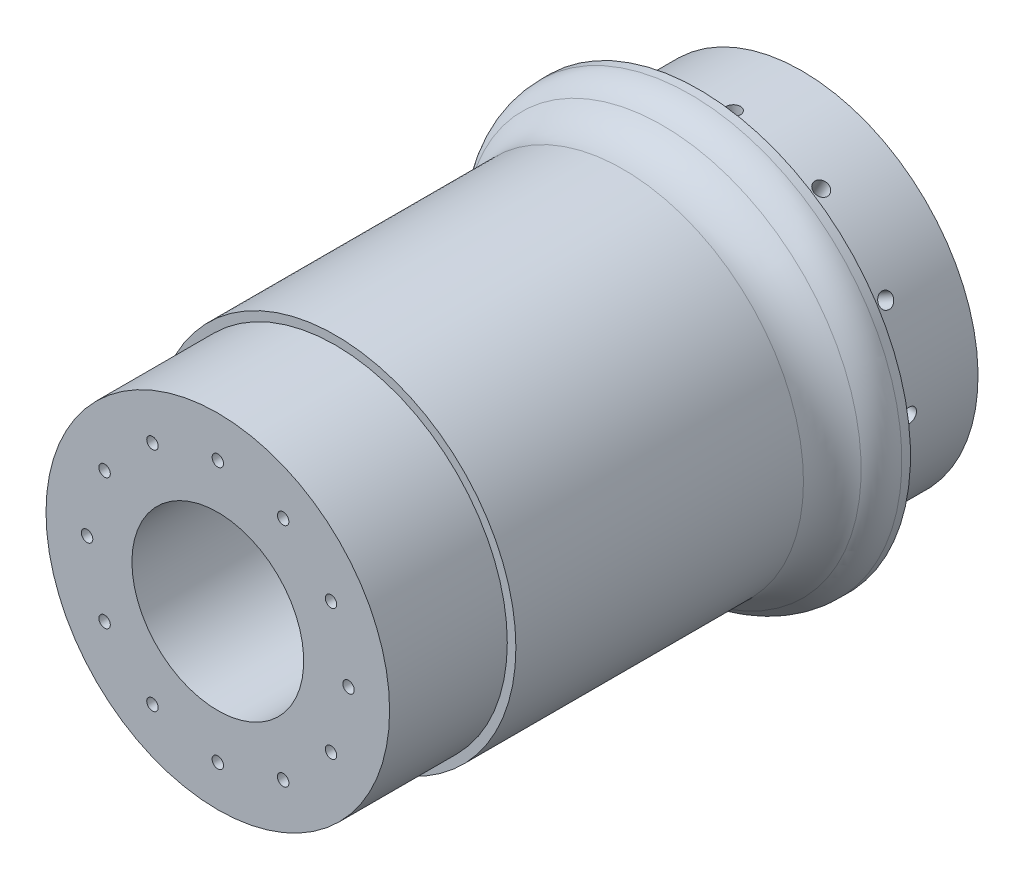
from build123d import *

# Parameters (mm, degrees)
SKETCH2_R           = 100
BOSS_EXTRUDE1_DEPTH = 68.5
SKETCH3_R           = 102.5
BOSS_EXTRUDE2_DEPTH = 60
HOLE1_D             = 8.376
HOLE1_DEPTH         = 85.864803313
HOLE2_D             = 8.376
HOLE2_DEPTH         = 85.864803313
HOLE3_D             = 8.376
HOLE3_DEPTH         = 40.780091351
HOLE4_D             = 8.376
HOLE4_DEPTH         = 85.864803313
HOLE5_D             = 8.376
HOLE5_DEPTH         = 85.864803313
HOLE6_D             = 8.376
HOLE6_DEPTH         = 40.780091351
HOLE7_D             = 8.376
HOLE7_DEPTH         = 85.864803313
HOLE8_D             = 8.376
HOLE8_DEPTH         = 85.864803313
HOLE9_D             = 8.376
HOLE9_DEPTH         = 40.780091351
HOLE10_D            = 8.376
HOLE10_DEPTH        = 85.864803313
HOLE11_D            = 8.376
HOLE11_DEPTH        = 85.864803313
HOLE12_D            = 8.376
HOLE12_DEPTH        = 40.780091351


with BuildPart() as part:
    # Sketch1 → Revolve1 (revolve)
    with BuildSketch(Plane.XZ):
        with BuildLine():
            Line((105, -68.5), (0, -68.5))
            Line((0, -68.5), (0, -280))
            Line((0, -280), (123.173723726, -280))
            Line((123.173723726, -280), (123.173723726, -275))
            ThreePointArc((123.173723726, -275), (121.202023829, -266.077620424), (115.654134038, -258.816947132))
            ThreePointArc((115.654134038, -258.816947132), (107.793603887, -248.529658909), (105, -235.887981387))
            Line((105, -235.887981387), (105, -68.5))
        make_face()
    revolve(axis=Axis((0, 0, -68.5), (0, 0, -1)))

    # Sketch2 → Boss-Extrude1 (add)
    with BuildSketch(Plane.XY.offset(-68.5)):
        Circle(SKETCH2_R)
    extrude(amount=BOSS_EXTRUDE1_DEPTH)

    # Sketch3 → Boss-Extrude2 (add)
    with BuildSketch(Plane(origin=(0, 0, -280), x_dir=(-1, 0, 0), z_dir=(0, 0, -1))):
        Circle(SKETCH3_R)
    extrude(amount=BOSS_EXTRUDE2_DEPTH)

    # Sketch4 → Cut-Revolve1 (revolve, cut)
    with BuildSketch(Plane.XZ):
        with BuildLine():
            Line((50, 0), (0, 0))
            Line((0, 0), (0, -340))
            Line((0, -340), (82.5, -340))
            Line((82.5, -340), (82.5, -153.326822519))
            ThreePointArc((82.5, -153.326822519), (78.117376915, -137.714327523), (66.25, -126.66341126))
            ThreePointArc((66.25, -126.66341126), (54.382623085, -115.612494996), (50, -100))
            Line((50, -100), (50, 0))
        make_face()
    revolve(axis=Axis((0, 0, 0), (0, 0, -1)), mode=Mode.SUBTRACT)

    # Sketch5 → Cut-Revolve2 (revolve, cut)
    with BuildSketch(Plane.XZ.offset(-76.095238095)):
        Polygon((3.3235, 0), (0, 0), (0, -18), (3.3235, -16.003039733), (3.3235, -12), align=None)
    revolve(axis=Axis((0, 76.095238095, 0), (0, 0, -1)), mode=Mode.SUBTRACT)

    # Sketch6 → Cut-Revolve3 (revolve, cut)
    with BuildSketch(Plane.XZ.offset(-65.900409298)):
        Polygon((41.371119048, 0), (38.047619048, 0), (38.047619048, -18), (41.371119048, -16.003039733), (41.371119048, -12), align=None)
    revolve(axis=Axis((38.047619048, 65.900409298, 0), (0, 0, -1)), mode=Mode.SUBTRACT)

    # Sketch7 → Cut-Revolve4 (revolve, cut)
    with BuildSketch(Plane.XZ.offset(-38.047619048)):
        Polygon((69.223909297, 0), (65.900409297, 0), (65.900409297, -18), (69.223909297, -16.003039733), (69.223909297, -12), align=None)
    revolve(axis=Axis((65.900409297, 38.047619048, 0), (0, 0, -1)), mode=Mode.SUBTRACT)

    # Sketch8 → Cut-Revolve5 (revolve, cut)
    with BuildSketch(Plane.XZ):
        Polygon((79.418738095, 0), (76.095238095, 0), (76.095238095, -18), (79.418738095, -16.003039733), (79.418738095, -12), align=None)
    revolve(axis=Axis((76.095238095, 0, 0), (0, 0, -1)), mode=Mode.SUBTRACT)

    # Sketch9 → Cut-Revolve6 (revolve, cut)
    with BuildSketch(Plane.XZ.offset(38.047619048)):
        Polygon((69.223909298, 0), (65.900409298, 0), (65.900409298, -18), (69.223909298, -16.003039733), (69.223909298, -12), align=None)
    revolve(axis=Axis((65.900409298, -38.047619048, 0), (0, 0, -1)), mode=Mode.SUBTRACT)

    # Sketch10 → Cut-Revolve7 (revolve, cut)
    with BuildSketch(Plane.XZ.offset(65.900409297)):
        Polygon((41.371119048, 0), (38.047619048, 0), (38.047619048, -18), (41.371119048, -16.003039733), (41.371119048, -12), align=None)
    revolve(axis=Axis((38.047619048, -65.900409297, 0), (0, 0, -1)), mode=Mode.SUBTRACT)

    # Sketch11 → Cut-Revolve8 (revolve, cut)
    with BuildSketch(Plane.XZ.offset(76.095238095)):
        Polygon((3.3235, 0), (0, 0), (0, -18), (3.3235, -16.003039733), (3.3235, -12), align=None)
    revolve(axis=Axis((0, -76.095238095, 0), (0, 0, -1)), mode=Mode.SUBTRACT)

    # Sketch12 → Cut-Revolve9 (revolve, cut)
    with BuildSketch(Plane.XZ.offset(65.900409297)):
        Polygon((-34.724119048, 0), (-38.047619048, 0), (-38.047619048, -18), (-34.724119048, -16.003039733), (-34.724119048, -12), align=None)
    revolve(axis=Axis((-38.047619048, -65.900409297, 0), (0, 0, -1)), mode=Mode.SUBTRACT)

    # Sketch13 → Cut-Revolve10 (revolve, cut)
    with BuildSketch(Plane.XZ.offset(38.047619048)):
        Polygon((-62.576909297, 0), (-65.900409297, 0), (-65.900409297, -18), (-62.576909297, -16.003039733), (-62.576909297, -12), align=None)
    revolve(axis=Axis((-65.900409297, -38.047619048, 0), (0, 0, -1)), mode=Mode.SUBTRACT)

    # Sketch14 → Cut-Revolve11 (revolve, cut)
    with BuildSketch(Plane.XZ):
        Polygon((-72.771738095, 0), (-76.095238095, 0), (-76.095238095, -18), (-72.771738095, -16.003039733), (-72.771738095, -12), align=None)
    revolve(axis=Axis((-76.095238095, 0, 0), (0, 0, -1)), mode=Mode.SUBTRACT)

    # Sketch15 → Cut-Revolve12 (revolve, cut)
    with BuildSketch(Plane.XZ.offset(-38.047619048)):
        Polygon((-62.576909298, 0), (-65.900409298, 0), (-65.900409298, -18), (-62.576909298, -16.003039733), (-62.576909298, -12), align=None)
    revolve(axis=Axis((-65.900409298, 38.047619048, 0), (0, 0, -1)), mode=Mode.SUBTRACT)

    # Sketch16 → Cut-Revolve13 (revolve, cut)
    with BuildSketch(Plane.XZ.offset(-65.900409298)):
        Polygon((-34.724119048, 0), (-38.047619048, 0), (-38.047619048, -18), (-34.724119048, -16.003039733), (-34.724119048, -12), align=None)
    revolve(axis=Axis((-38.047619048, 65.900409298, 0), (0, 0, -1)), mode=Mode.SUBTRACT)

    # Hole1
    with Locations(Plane(origin=(71.354978747, -41.196816188, 0), x_dir=(0, 0, 1), z_dir=(-0.8660254037844389, 0.49999999999999983, 0))):
        with Locations((-300, 0)):
            Hole(HOLE1_D / 2, depth=HOLE1_DEPTH)

    # Hole2
    with Locations(Plane(origin=(41.196816188, -71.354978747, 0), x_dir=(0.8660254037844385, 0.5000000000000004, 0), z_dir=(-0.5000000000000003, 0.8660254037844384, 0))):
        with Locations((0, 300)):
            Hole(HOLE2_D / 2, depth=HOLE2_DEPTH)

    # Hole3
    with Locations(Plane(origin=(0, -82.393632375, 0), x_dir=(1, 0, 0), z_dir=(0, 1, 0))):
        with Locations((0, 300)):
            Hole(HOLE3_D / 2, depth=HOLE3_DEPTH)

    # Hole4
    with Locations(Plane(origin=(-41.196816188, -71.354978747, 0), x_dir=(0.8660254037844387, -0.4999999999999999, 0), z_dir=(0.4999999999999999, 0.8660254037844387, 0))):
        with Locations((0, 300)):
            Hole(HOLE4_D / 2, depth=HOLE4_DEPTH)

    # Hole5
    with Locations(Plane(origin=(-71.354978747, -41.196816188, 0), x_dir=(0, 0, -1), z_dir=(0.8660254037844387, 0.4999999999999999, 0))):
        with Locations((300, 0)):
            Hole(HOLE5_D / 2, depth=HOLE5_DEPTH)

    # Hole6
    with Locations(Plane(origin=(-82.393632375, 0, 0), x_dir=(0, 0, -1), z_dir=(1, 0, 0))):
        with Locations((300, 0)):
            Hole(HOLE6_D / 2, depth=HOLE6_DEPTH)

    # Hole7
    with Locations(Plane(origin=(-71.354978747, 41.196816188, 0), x_dir=(0, 0, -1), z_dir=(0.8660254037844387, -0.4999999999999999, 0))):
        with Locations((300, 0)):
            Hole(HOLE7_D / 2, depth=HOLE7_DEPTH)

    # Hole8
    with Locations(Plane(origin=(-41.196816188, 71.354978747, 0), x_dir=(-0.8660254037844387, -0.4999999999999999, 0), z_dir=(0.4999999999999999, -0.8660254037844387, 0))):
        with Locations((0, 300)):
            Hole(HOLE8_D / 2, depth=HOLE8_DEPTH)

    # Hole9
    with Locations(Plane(origin=(0, 82.393632375, 0), x_dir=(-1, 0, 0), z_dir=(0, -1, 0))):
        with Locations((0, 300)):
            Hole(HOLE9_D / 2, depth=HOLE9_DEPTH)

    # Hole10
    with Locations(Plane(origin=(41.196816188, 71.354978747, 0), x_dir=(-0.8660254037844387, 0.4999999999999999, 0), z_dir=(-0.4999999999999999, -0.8660254037844387, 0))):
        with Locations((0, 300)):
            Hole(HOLE10_D / 2, depth=HOLE10_DEPTH)

    # Hole11
    with Locations(Plane(origin=(71.354978747, 41.196816188, 0), x_dir=(0, 0, 1), z_dir=(-0.8660254037844384, -0.5000000000000003, 0))):
        with Locations((-300, 0)):
            Hole(HOLE11_D / 2, depth=HOLE11_DEPTH)

    # Hole12
    with Locations(Plane.ZY.offset(-82.393632375)):
        with Locations((-300, 0)):
            Hole(HOLE12_D / 2, depth=HOLE12_DEPTH)


solid = part.part
